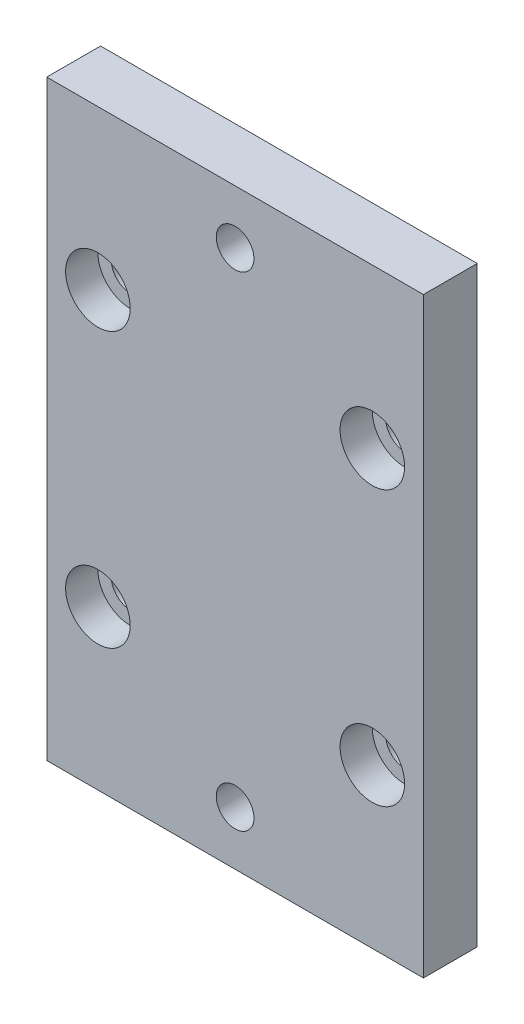
from build123d import *

# Parameters (mm, degrees)
SKETCH1_W           = 35
SKETCH1_H           = 55
SKETCH1_R           = 1.75
BOSS_EXTRUDE1_DEPTH = 5
SKETCH2_R           = 3
CUT_EXTRUDE1_DEPTH  = 3
CHAMFER1_SIZE       = 2


with BuildPart() as part:
    # Sketch1 → Boss-Extrude1 (new body)
    with BuildSketch(Plane.XY):
        with Locations((17.5, 27.5)):
            Rectangle(SKETCH1_W, SKETCH1_H)
        with Locations((4.75, 40.25)):
            Circle(SKETCH1_R, mode=Mode.SUBTRACT)
        with Locations((30.25, 40.25)):
            Circle(SKETCH1_R, mode=Mode.SUBTRACT)
        with Locations((30.25, 14.75)):
            Circle(SKETCH1_R, mode=Mode.SUBTRACT)
        with Locations((4.75, 14.75)):
            Circle(SKETCH1_R, mode=Mode.SUBTRACT)
        with Locations((17.5, 50)):
            Circle(SKETCH1_R, mode=Mode.SUBTRACT)
        with Locations((17.5, 5)):
            Circle(SKETCH1_R, mode=Mode.SUBTRACT)
    extrude(amount=BOSS_EXTRUDE1_DEPTH)

    # Sketch2 → Cut-Extrude1 (cut)
    with BuildSketch(Plane.XY.offset(5)):
        with Locations((4.75, 40.25)):
            Circle(SKETCH2_R)
        with Locations((30.25, 40.25)):
            Circle(SKETCH2_R)
        with Locations((30.25, 14.75)):
            Circle(SKETCH2_R)
        with Locations((4.75, 14.75)):
            Circle(SKETCH2_R)
    extrude(amount=-CUT_EXTRUDE1_DEPTH, mode=Mode.SUBTRACT)

    # Chamfer1
    chamfer1_edges = [part.edges().sort_by_distance(p)[0] for p in [
        (15.75, 50, 0),
        (15.75, 5, 0),
    ]]
    chamfer(chamfer1_edges, length=CHAMFER1_SIZE)


solid = part.part
